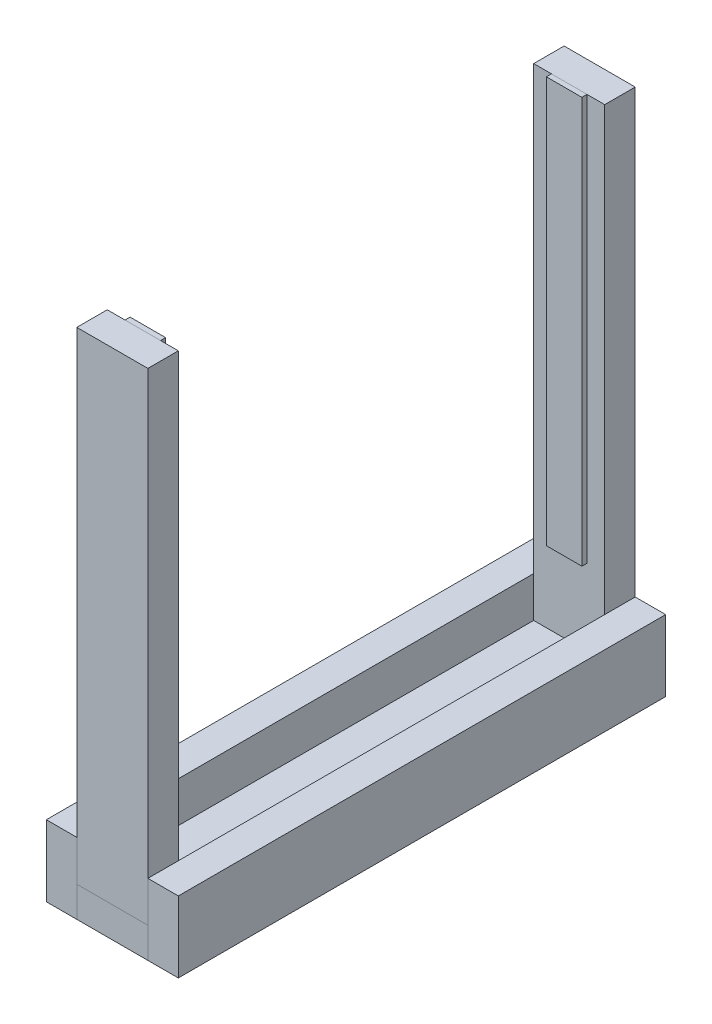
from build123d import *

# Parameters (mm, degrees)
SKETCH1_W             = 88.9
SKETCH1_H             = 609.6
BASE_BOARD_DEPTH      = 38.1
SKETCH2_W             = 88.9
SKETCH2_H             = 38.1
VERTICAL_BOARD_DEPTH  = 603.25
SKETCH3_W             = 609.6
SKETCH3_H             = 88.9
LATERAL_SUPPORT_DEPTH = 38.1
SKETCH4_W             = 44.45
SKETCH4_H             = 508
DRAWER_SLIDE_DEPTH    = 6.35


with BuildPart() as part:
    # Sketch1 → Base Board (new body)
    with BuildSketch(Plane(origin=(0, 0, 0), x_dir=(1, 0, 0), z_dir=(0, 1, 0))):
        Rectangle(SKETCH1_W, SKETCH1_H)
    extrude(amount=BASE_BOARD_DEPTH)


with BuildPart() as body_2:
    # Sketch2 → Vertical Board (new body)
    with BuildSketch(Plane(origin=(0, 38.1, 0), x_dir=(1, 0, 0), z_dir=(0, 1, 0))):
        with Locations((0, -285.75)):
            Rectangle(SKETCH2_W, SKETCH2_H)
    extrude(amount=VERTICAL_BOARD_DEPTH)


with BuildPart() as body_3:
    # Vertical Board Mirror: mirrored copy
    add(body_2.part.mirror(Plane.XY))


with BuildPart() as body_4:
    # Sketch3 → Lateral Support (new body)
    with BuildSketch(Plane(origin=(44.45, 0, 0), x_dir=(0, 0, -1), z_dir=(1, 0, 0))):
        with Locations((0, 44.45)):
            Rectangle(SKETCH3_W, SKETCH3_H)
    extrude(amount=LATERAL_SUPPORT_DEPTH)


with BuildPart() as body_5:
    # Lateral Support Mirror: mirrored copy
    add(body_4.part.mirror(Plane(origin=(0, 0, 0), x_dir=(0, 0, 1), z_dir=(1, 0, 0))))


with BuildPart() as body_6:
    # Sketch4 → Drawer Slide (new body)
    with BuildSketch(Plane(origin=(0, 0, 266.7), x_dir=(-1, 0, 0), z_dir=(0, 0, -1))):
        with Locations((0, 387.35)):
            Rectangle(SKETCH4_W, SKETCH4_H)
    extrude(amount=DRAWER_SLIDE_DEPTH)


with BuildPart() as body_7:
    # Drawer Slide Mirror: mirrored copy
    add(body_6.part.mirror(Plane.XY))


solid = Compound([part.part, body_2.part, body_3.part, body_4.part, body_5.part, body_6.part, body_7.part])
